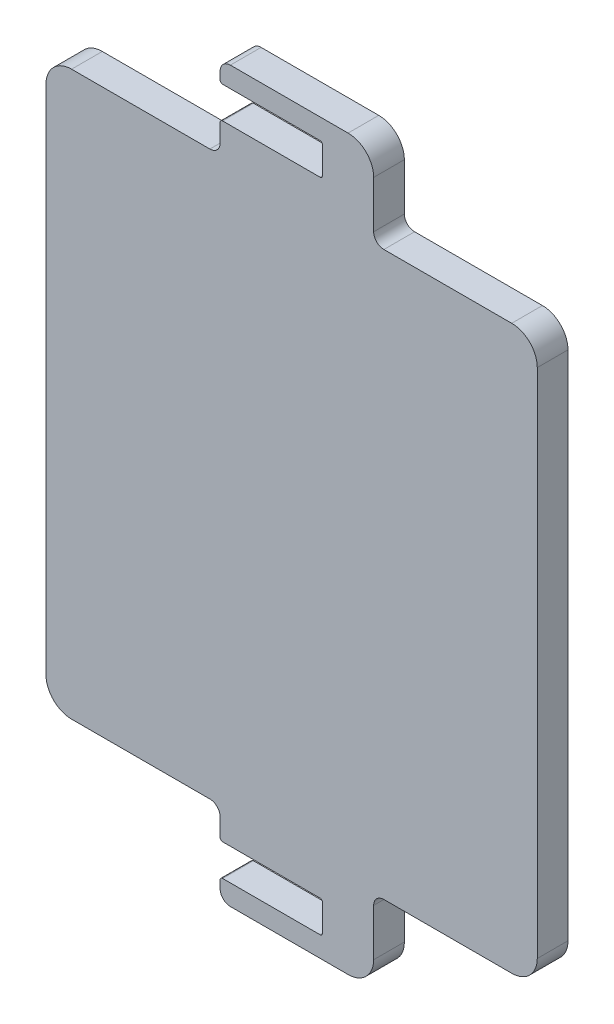
from build123d import *

# Parameters (mm, degrees)
SALIENTE_EXTRUIR2_DEPTH = 3
REDONDEO1_R             = 1
REDONDEO2_R             = 0.25


with BuildPart() as part:
    # Croquis1 → Saliente-Extruir2 (new body)
    with BuildSketch(Plane.XY):
        with BuildLine():
            Line((-24, 25), (-24, -25))
            ThreePointArc((-24, -25), (-23.267766953, -26.767766953), (-21.5, -27.5))
            Line((-21.5, -27.5), (-6.98733674, -27.5))
            Line((-6.98733674, -27.5), (-6.98733674, -30.5))
            Line((-6.98733674, -30.5), (3.01266326, -30.5))
            Line((3.01266326, -30.5), (3.01266326, -33.6))
            Line((3.01266326, -33.6), (-6.98733674, -33.6))
            Line((-6.98733674, -33.6), (-6.98733674, -35.6))
            Line((-6.98733674, -35.6), (5.51266326, -35.6))
            ThreePointArc((5.51266326, -35.6), (7.280430213, -34.867766953), (8.01266326, -33.1))
            Line((8.01266326, -33.1), (8.01266326, -27.5))
            Line((8.01266326, -27.5), (21.5, -27.5))
            ThreePointArc((21.5, -27.5), (23.267766953, -26.767766953), (24, -25))
            Line((24, -25), (24, 25))
            ThreePointArc((24, 25), (23.267766953, 26.767766953), (21.5, 27.5))
            Line((21.5, 27.5), (8.01266326, 27.5))
            Line((8.01266326, 27.5), (8.01266326, 33.1))
            ThreePointArc((8.01266326, 33.1), (7.280430213, 34.867766953), (5.51266326, 35.6))
            Line((5.51266326, 35.6), (-6.98733674, 35.6))
            Line((-6.98733674, 35.6), (-6.98733674, 33.6))
            Line((-6.98733674, 33.6), (3.01266326, 33.6))
            Line((3.01266326, 33.6), (3.01266326, 30.5))
            Line((3.01266326, 30.5), (-6.98733674, 30.5))
            Line((-6.98733674, 30.5), (-6.98733674, 27.5))
            Line((-6.98733674, 27.5), (-21.5, 27.5))
            ThreePointArc((-21.5, 27.5), (-23.267766953, 26.767766953), (-24, 25))
        make_face()
    extrude(amount=SALIENTE_EXTRUIR2_DEPTH)

    # Redondeo1
    redondeo1_edges = [part.edges().sort_by_distance(p)[0] for p in [
        (-6.98733674, 35.6, 1.5),
        (8.01266326, 27.5, 1.5),
        (8.01266326, -27.5, 1.5),
        (-6.98733674, -35.6, 1.5),
        (-6.98733674, -27.5, 1.5),
        (-6.98733674, 27.5, 1.5),
    ]]
    fillet(redondeo1_edges, radius=REDONDEO1_R)

    # Redondeo2
    redondeo2_edges = [part.edges().sort_by_distance(p)[0] for p in [
        (-6.98733674, -33.6, 1.5),
        (3.01266326, -33.6, 1.5),
        (3.01266326, -30.5, 1.5),
        (-6.98733674, -30.5, 1.5),
        (-6.98733674, 30.5, 1.5),
        (3.01266326, 30.5, 1.5),
        (3.01266326, 33.6, 1.5),
        (-6.98733674, 33.6, 1.5),
    ]]
    fillet(redondeo2_edges, radius=REDONDEO2_R)


solid = part.part
